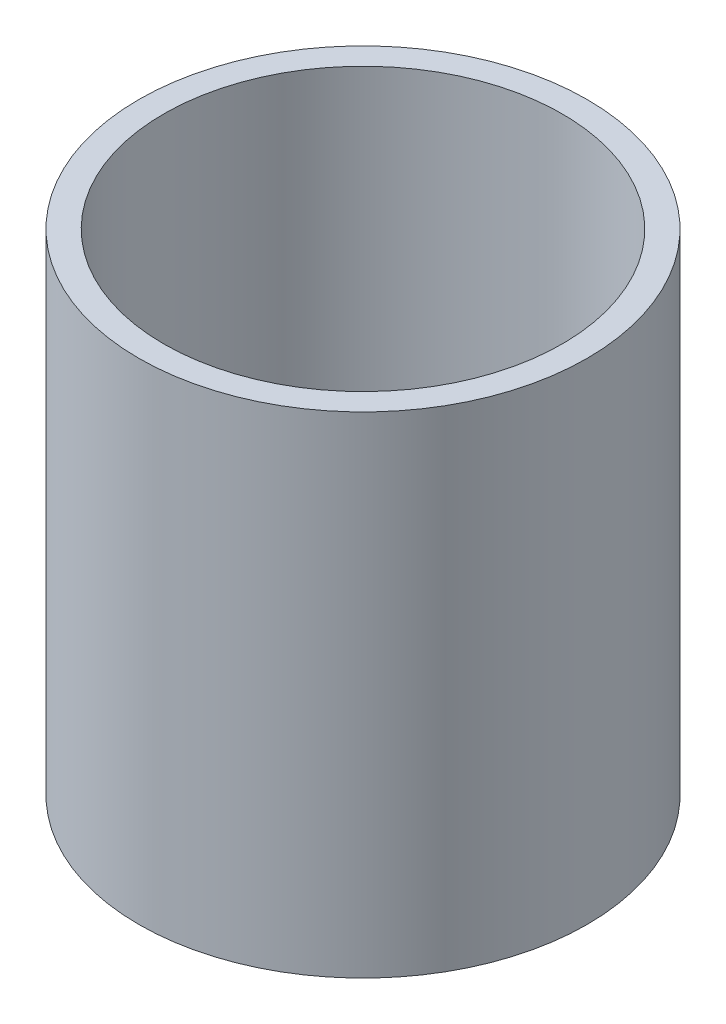
from build123d import *

# Parameters (mm, degrees)
SKETCH2_R           = 22.86
SKETCH2_R_2         = 20.32
BOSS_EXTRUDE1_DEPTH = 50


with BuildPart() as part:
    # Sketch2 → Boss-Extrude1 (new body)
    with BuildSketch(Plane(origin=(0, 0, 0), x_dir=(1, 0, 0), z_dir=(0, 1, 0))):
        with Locations(Location((0, 0, 0), (0, 0, 270))):
            Circle(SKETCH2_R)
        with Locations(Location((0, 0, 0), (0, 0, 270))):
            Circle(SKETCH2_R_2, mode=Mode.SUBTRACT)
    extrude(amount=BOSS_EXTRUDE1_DEPTH)


solid = part.part
